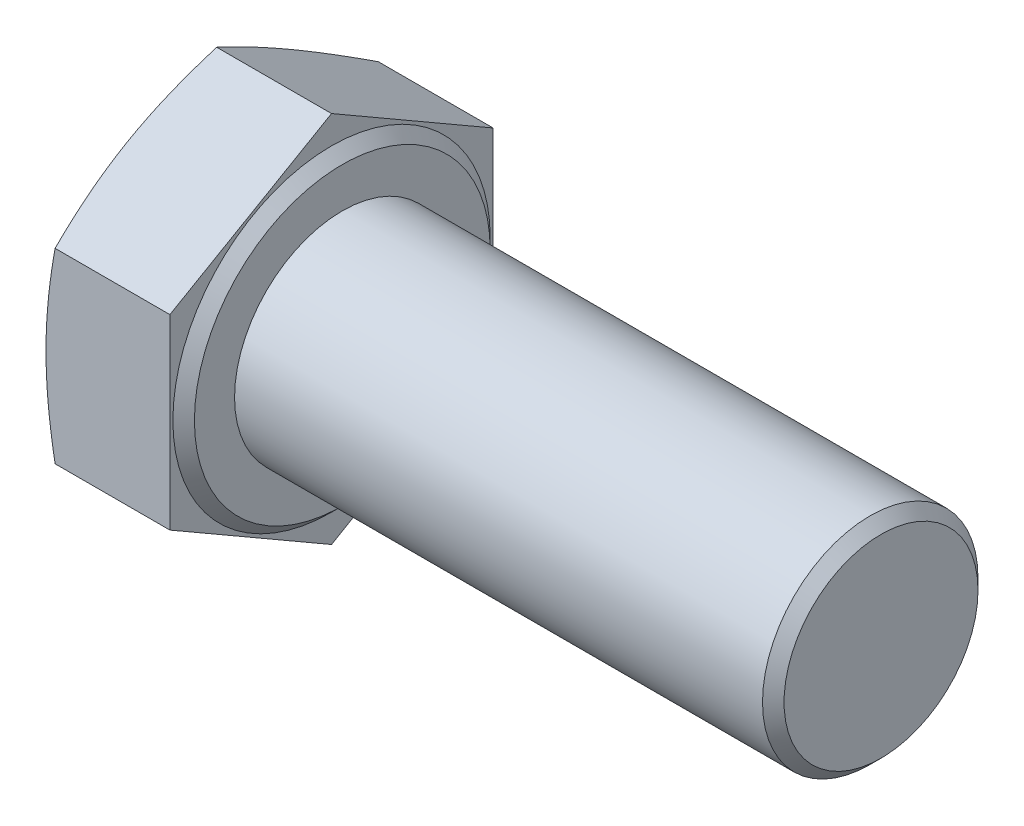
from build123d import *

# Parameters (mm, degrees)
BASEHEAD_DEPTH = 7.5
SKETCH5_R      = 6
BASEBODY_DEPTH = 30
CHAMFER1_SIZE  = 0.6


with BuildPart() as part:
    # Sketch2 → BaseHead (new body)
    with BuildSketch(Plane(origin=(0, 0, 0), x_dir=(0, 0, -1), z_dir=(1, 0, 0))):
        Polygon((0, -10.392304845), (9, -5.196152423), (9, 5.196152423), (0, 10.392304845), (-9, 5.196152423), (-9, -5.196152423), align=None)
    extrude(amount=BASEHEAD_DEPTH)

    # Sketch3 → BearingFace (revolve, cut)
    with BuildSketch(Plane.XY, mode=Mode.PRIVATE) as bearingface_sk:
        Polygon((7.5, 10.392304845), (7.5, 8.235), (6.9, 8.835), (6.9, 10.392304845), align=None)
    revolve(bearingface_sk.sketch.rotate(Axis((-0.957090588, 0, 0), (1, 0, 0)), 90), axis=Axis((-0.957090588, 0, 0), (1, 0, 0)), mode=Mode.SUBTRACT)

    # Sketch4 → HeadChamfer (revolve, cut)
    with BuildSketch(Plane.XY):
        Polygon((0, 10.392304845), (0.506757521, 10.392304845), (0, 9), align=None)
    revolve(axis=Axis((-0.493528746, 0, 0), (1, 0, 0)), mode=Mode.SUBTRACT)

    # Sketch5 → BaseBody (add)
    with BuildSketch(Plane(origin=(7.5, 0, 0), x_dir=(0, 0, -1), z_dir=(1, 0, 0))):
        Circle(SKETCH5_R)
    extrude(amount=BASEBODY_DEPTH)

    # Chamfer1
    chamfer1_edges = [part.edges().sort_by_distance(p)[0] for p in [
        (37.5, 0, 6),
    ]]
    chamfer(chamfer1_edges, length=CHAMFER1_SIZE)


solid = part.part
